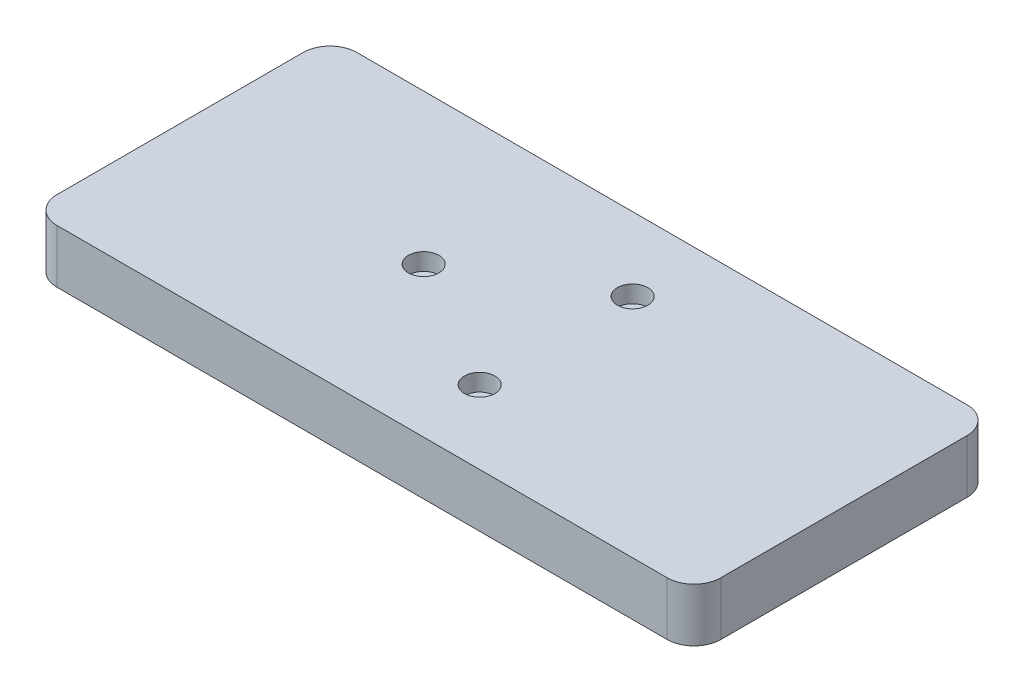
from build123d import *

# Parameters (mm, degrees)
SKIZZE1_W                       = 124
SKIZZE1_H                       = 56
AUFSATZ_LINEAR_AUSTRAGEN1_DEPTH = 10
VERRUNDUNG1_R                   = 5
SCHNITT_LINEAR_AUSTRAGEN1_REACH = 70.76
SKIZZE2_R                       = 1.55
SKIZZE3_R                       = 2.85
SCHNITT_LINEAR_AUSTRAGEN2_DEPTH = 3.2


with BuildPart() as part:
    # Skizze1 → Aufsatz-Linear austragen1 (new body)
    with BuildSketch(Plane(origin=(0, 0, 0), x_dir=(1, 0, 0), z_dir=(0, 1, 0))):
        Rectangle(SKIZZE1_W, SKIZZE1_H)
    extrude(amount=AUFSATZ_LINEAR_AUSTRAGEN1_DEPTH)

    # Verrundung1
    verrundung1_edges = [part.edges().sort_by_distance(p)[0] for p in [
        (62, 5, -28),
        (62, 5, 28),
        (-62, 5, 28),
        (-62, 5, -28),
    ]]
    fillet(verrundung1_edges, radius=VERRUNDUNG1_R)

    # Skizze2 → Schnitt-Linear austragen1 (cut, up to next)
    with BuildSketch(Plane(origin=(0, 10, 0), x_dir=(1, 0, 0), z_dir=(0, 1, 0)), mode=Mode.PRIVATE) as schnitt_linear_austragen1_sk1:
        with Locations(Location((-16.5, 0, 0), (0, 0, 270))):
            Circle(SKIZZE2_R)
    schnitt_linear_austragen1_tool1 = extrude(schnitt_linear_austragen1_sk1.sketch, amount=-SCHNITT_LINEAR_AUSTRAGEN1_REACH, mode=Mode.PRIVATE) & part.part
    # Skizze2 → Schnitt-Linear austragen1 (cut, up to next)
    with BuildSketch(Plane(origin=(0, 10, 0), x_dir=(1, 0, 0), z_dir=(0, 1, 0)), mode=Mode.PRIVATE) as schnitt_linear_austragen1_sk2:
        with Locations(Location((8.25, 14.289419162, 0), (0, 0, 270))):
            Circle(SKIZZE2_R)
    schnitt_linear_austragen1_tool2 = extrude(schnitt_linear_austragen1_sk2.sketch, amount=-SCHNITT_LINEAR_AUSTRAGEN1_REACH, mode=Mode.PRIVATE) & part.part
    # Skizze2 → Schnitt-Linear austragen1 (cut, up to next)
    with BuildSketch(Plane(origin=(0, 10, 0), x_dir=(1, 0, 0), z_dir=(0, 1, 0)), mode=Mode.PRIVATE) as schnitt_linear_austragen1_sk3:
        with Locations(Location((8.25, -14.289419162, 0), (0, 0, 270))):
            Circle(SKIZZE2_R)
    schnitt_linear_austragen1_tool3 = extrude(schnitt_linear_austragen1_sk3.sketch, amount=-SCHNITT_LINEAR_AUSTRAGEN1_REACH, mode=Mode.PRIVATE) & part.part
    add(schnitt_linear_austragen1_tool1.solids().sort_by_distance((-16.5, 10, 0))[0], mode=Mode.SUBTRACT)
    add(schnitt_linear_austragen1_tool2.solids().sort_by_distance((8.25, 10, -14.289419))[0], mode=Mode.SUBTRACT)
    add(schnitt_linear_austragen1_tool3.solids().sort_by_distance((8.25, 10, 14.289419))[0], mode=Mode.SUBTRACT)

    # Skizze3 → Schnitt-Linear austragen2 (cut)
    with BuildSketch(Plane(origin=(0, 10, 0), x_dir=(1, 0, 0), z_dir=(0, 1, 0))):
        with Locations(Location((8.25, 14.289419162, 0), (0, 0, 270))):
            Circle(SKIZZE3_R)
        with Locations(Location((-16.5, 0, 0), (0, 0, 270))):
            Circle(SKIZZE3_R)
        with Locations(Location((8.25, -14.289419162, 0), (0, 0, 270))):
            Circle(SKIZZE3_R)
    extrude(amount=-SCHNITT_LINEAR_AUSTRAGEN2_DEPTH, mode=Mode.SUBTRACT)


solid = part.part
